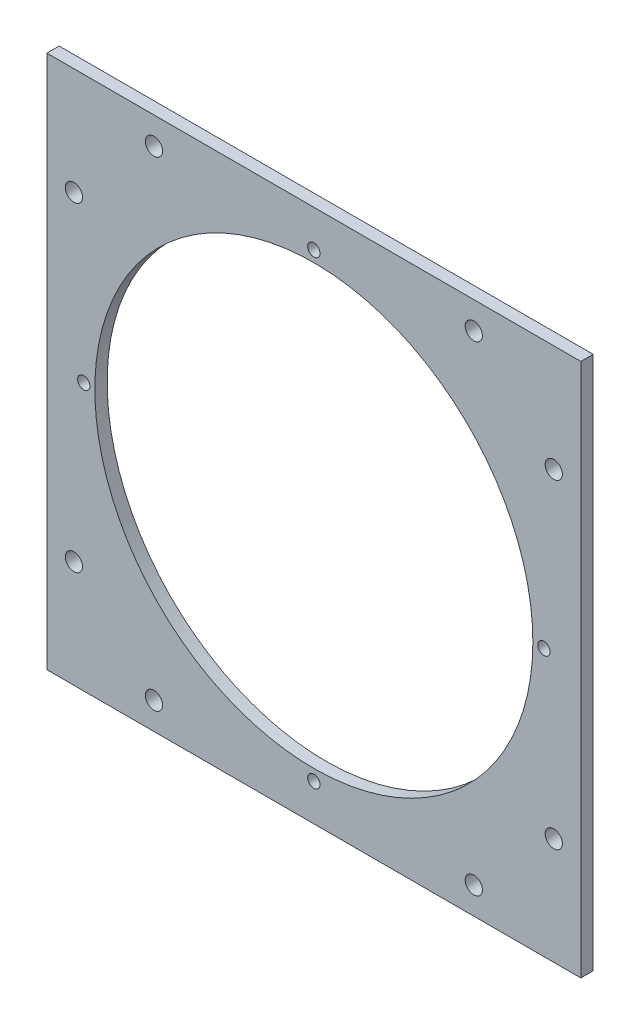
from build123d import *

# Parameters (mm, degrees)
SKETCH2_W           = 217
SKETCH2_H           = 217
SKETCH2_R           = 89
SKETCH2_R_2         = 3.5
BOSS_EXTRUDE1_DEPTH = 5
M6_TAPPED_HOLE1_D   = 5
CIRPATTERN1_COUNT   = 4


with BuildPart() as part:
    # Sketch2 → Boss-Extrude1 (new body)
    with BuildSketch(Plane.XY):
        Rectangle(SKETCH2_W, SKETCH2_H)
        Circle(SKETCH2_R, mode=Mode.SUBTRACT)
        with Locations((-97.5, -65)):
            Circle(SKETCH2_R_2, mode=Mode.SUBTRACT)
        with Locations((-97.5, 65)):
            Circle(SKETCH2_R_2, mode=Mode.SUBTRACT)
        with Locations(Location((97.5, 65, 0), (0, 0, 180))):
            Circle(SKETCH2_R_2, mode=Mode.SUBTRACT)
        with Locations(Location((97.5, -65, 0), (0, 0, 180))):
            Circle(SKETCH2_R_2, mode=Mode.SUBTRACT)
        with Locations((-65, -97.5)):
            Circle(SKETCH2_R_2, mode=Mode.SUBTRACT)
        with Locations((65, -97.5)):
            Circle(SKETCH2_R_2, mode=Mode.SUBTRACT)
        with Locations(Location((65, 97.5, 0), (0, 0, 180))):
            Circle(SKETCH2_R_2, mode=Mode.SUBTRACT)
        with Locations(Location((-65, 97.5, 0), (0, 0, 180))):
            Circle(SKETCH2_R_2, mode=Mode.SUBTRACT)
    extrude(amount=BOSS_EXTRUDE1_DEPTH)

    # M6 Tapped Hole1 (through all)
    with Locations(Plane(origin=(0, 0, 0), x_dir=(-1, 0, 0), z_dir=(0, 0, -1))):
        with Locations((0, -93.5)):
            m6_tapped_hole1 = Hole(M6_TAPPED_HOLE1_D / 2)

    # CirPattern1: M6 Tapped Hole1 ×4 about axis
    cirpattern1_axis = Axis((0, 0, 0), (0, 0, 1))
    for i in range(1, CIRPATTERN1_COUNT):
        add(m6_tapped_hole1.rotate(cirpattern1_axis, i * 360 / CIRPATTERN1_COUNT), mode=Mode.SUBTRACT)


solid = part.part
